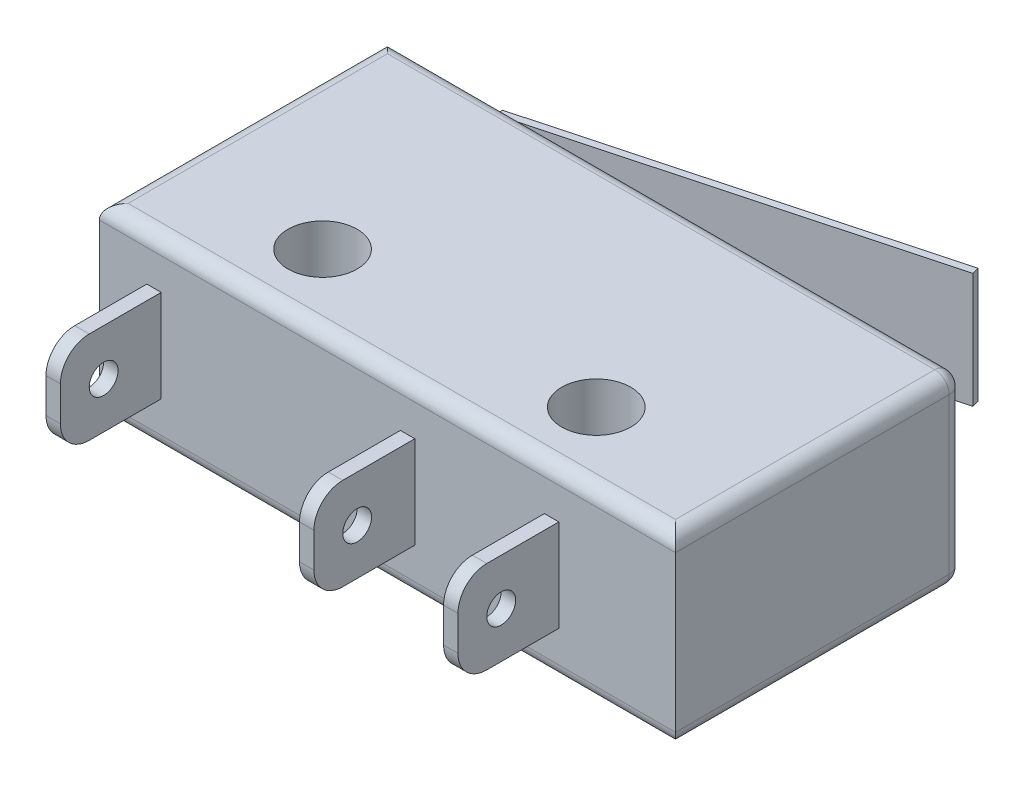
from build123d import *

# Parameters (mm, degrees)
SKETCH1_W                = 20
SKETCH1_H                = 10
SKETCH1_R                = 1.2
BOSS_EXTRUDE1_DEPTH      = 6.4
SKETCH2_W                = 0.5
SKETCH2_H                = 3.2
BOSS_EXTRUDE2_DEPTH      = 3.5
SKETCH3_R                = 0.5
CUT_EXTRUDE1_DEPTH       = 22.855948847
FILLET1_R                = 1
FILLET2_R                = 0.5
EXTRUDE_THIN2_DEPTH      = 2
EXTRUDE_THIN2_DEPTH_BACK = 2
BOSS_EXTRUDE6_DEPTH      = 0.5
BOSS_EXTRUDE6_DEPTH_BACK = 0.5


with BuildPart() as part:
    # Sketch1 → Boss-Extrude1 (new body)
    with BuildSketch(Plane(origin=(0, 0, 0), x_dir=(1, 0, 0), z_dir=(0, 1, 0))):
        with Locations((10, 5)):
            Rectangle(SKETCH1_W, SKETCH1_H)
        with Locations(Location((5.25, 2.5, 0), (0, 0, 270))):
            Circle(SKETCH1_R, mode=Mode.SUBTRACT)
        with Locations(Location((14.75, 2.5, 0), (0, 0, 270))):
            Circle(SKETCH1_R, mode=Mode.SUBTRACT)
    extrude(amount=BOSS_EXTRUDE1_DEPTH)

    # Sketch2 → Boss-Extrude2 (add)
    with BuildSketch(Plane.XY):
        with Locations((15.7, 3.2)):
            Rectangle(SKETCH2_W, SKETCH2_H)
        with Locations((10.7, 3.2)):
            Rectangle(SKETCH2_W, SKETCH2_H)
        with Locations((1.9, 3.2)):
            Rectangle(SKETCH2_W, SKETCH2_H)
    extrude(amount=BOSS_EXTRUDE2_DEPTH)

    # Sketch3 → Cut-Extrude1 (cut, through all)
    with BuildSketch(Plane.ZY.offset(-1.65)):
        with Locations(Location((2, 3.2, 0), (0, 0, 270))):
            Circle(SKETCH3_R)
    extrude(amount=-CUT_EXTRUDE1_DEPTH, mode=Mode.SUBTRACT)

    # Fillet1
    fillet1_edges = [part.edges().sort_by_distance(p)[0] for p in [
        (15.7, 1.6, 3.5),
        (15.7, 4.8, 3.5),
        (10.7, 4.8, 3.5),
        (10.7, 1.6, 3.5),
        (1.9, 4.8, 3.5),
        (1.9, 1.6, 3.5),
    ]]
    fillet(fillet1_edges, radius=FILLET1_R)

    # Fillet2
    fillet2_edges = [part.edges().sort_by_distance(p)[0] for p in [
        (20, 6.4, -5),
        (10, 6.4, -10),
        (0, 6.4, -5),
        (10, 0, -10),
        (20, 0, -5),
        (10, 0, 0),
        (0, 0, -5),
        (10, 6.4, 0),
        (20, 3.2, -10),
    ]]
    fillet(fillet2_edges, radius=FILLET2_R)

    # Sketch4 → Extrude-Thin2 (add, two sides: drawn at the far end of the back side and taken through both)
    with BuildSketch(Plane(origin=(0, 3.2, 0), x_dir=(1, 0, 0), z_dir=(0, 1, 0)).offset(-EXTRUDE_THIN2_DEPTH_BACK)):
        Polygon((3, 10), (3, 11), (16, 14.5), (16.064993368, 14.25859606), (3.25, 10.808405538), (3.25, 10), align=None)
    extrude(amount=EXTRUDE_THIN2_DEPTH + EXTRUDE_THIN2_DEPTH_BACK)


with BuildPart() as body_2:
    # Sketch5 → Boss-Extrude6 (new, two sides: drawn at the far end of the back side and taken through both)
    with BuildSketch(Plane(origin=(0, 3.2, 0), x_dir=(1, 0, 0), z_dir=(0, 1, 0)).offset(-BOSS_EXTRUDE6_DEPTH_BACK)):
        with BuildLine():
            Line((4.75, 10), (4.75, 10.637468306))
            ThreePointArc((4.75, 10.637468306), (5.5, 11.387468306), (6.25, 10.637468306))
            Line((6.25, 10.637468306), (6.25, 10))
            Line((6.25, 10), (4.75, 10))
        make_face()
    extrude(amount=BOSS_EXTRUDE6_DEPTH + BOSS_EXTRUDE6_DEPTH_BACK)


solid = Compound([part.part, body_2.part])
